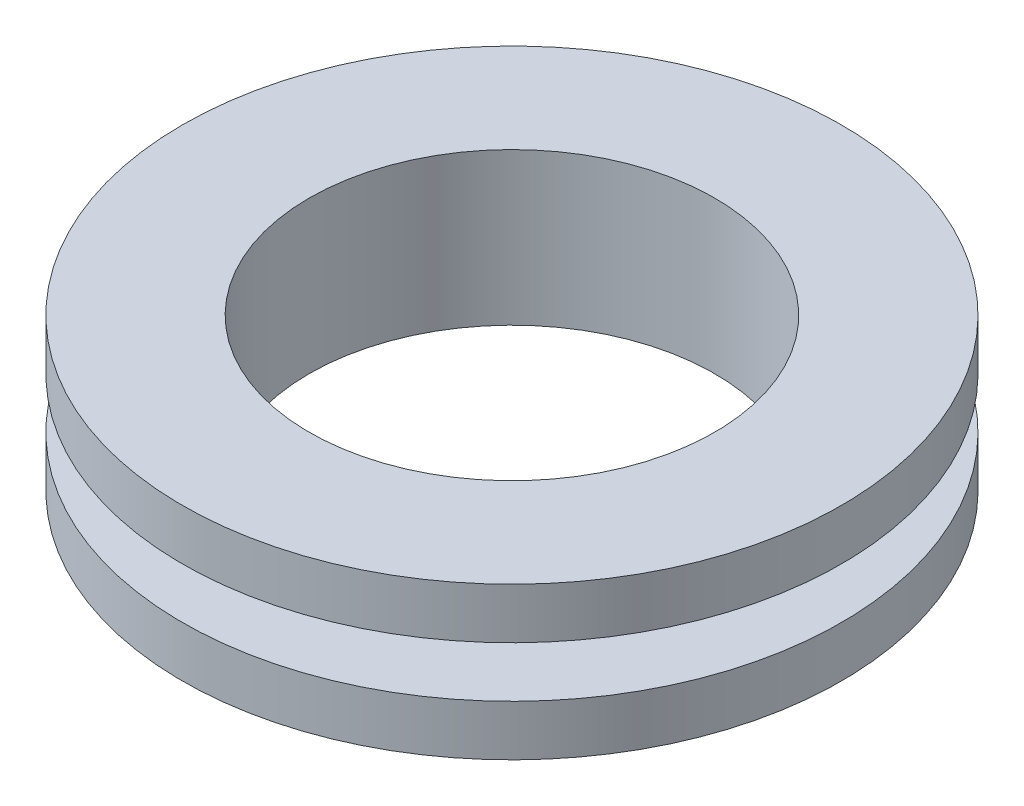
from build123d import *


with BuildPart() as part:
    # Sketch1 → Revolve1 (revolve)
    with BuildSketch(Plane.XY, mode=Mode.PRIVATE) as revolve1_sk:
        Polygon((5, 0.5), (5, -0.5), (6.5, -0.5), (6.5, -1.5), (4, -1.5), (4, 1.5), (6.5, 1.5), (6.5, 0.5), align=None)
    revolve(revolve1_sk.sketch.rotate(Axis((0, 3.800150025, 0), (0, -1, 0)), 180), axis=Axis((0, 3.800150025, 0), (0, -1, 0)))


solid = part.part
